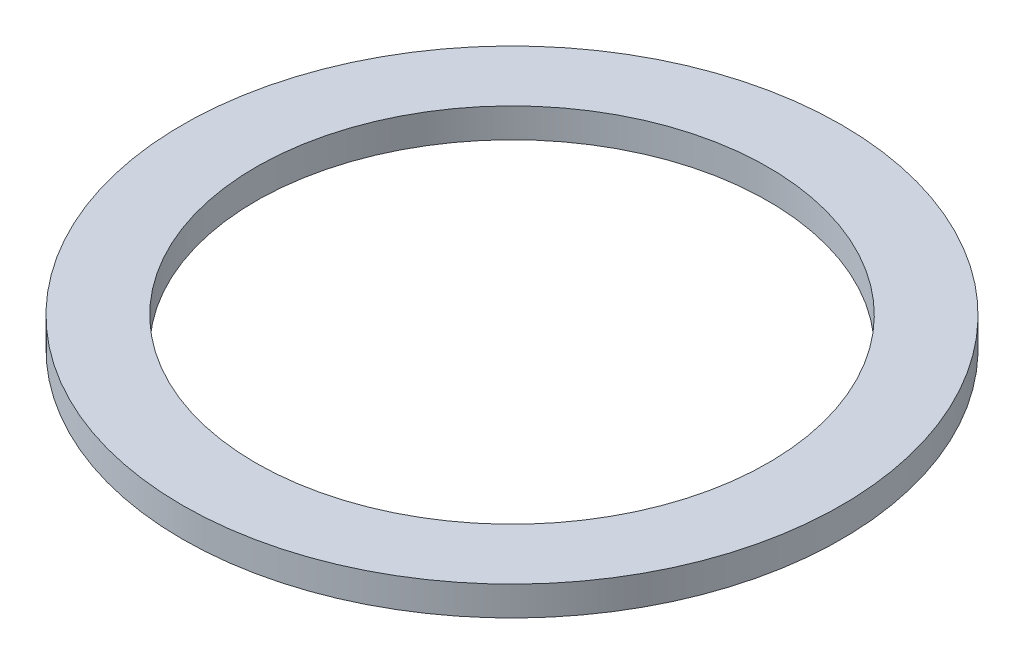
from build123d import *

# Parameters (mm, degrees)
SKETCH1_R           = 22.46
SKETCH1_R_2         = 17.46
BOSS_EXTRUDE1_DEPTH = 2


with BuildPart() as part:
    # Sketch1 → Boss-Extrude1 (new body)
    with BuildSketch(Plane(origin=(0, 0, 0), x_dir=(1, 0, 0), z_dir=(0, 1, 0))):
        with Locations(Location((0, 0, 0), (0, 0, 270))):
            Circle(SKETCH1_R)
        with Locations(Location((0, 0, 0), (0, 0, 270))):
            Circle(SKETCH1_R_2, mode=Mode.SUBTRACT)
    extrude(amount=BOSS_EXTRUDE1_DEPTH)


solid = part.part
